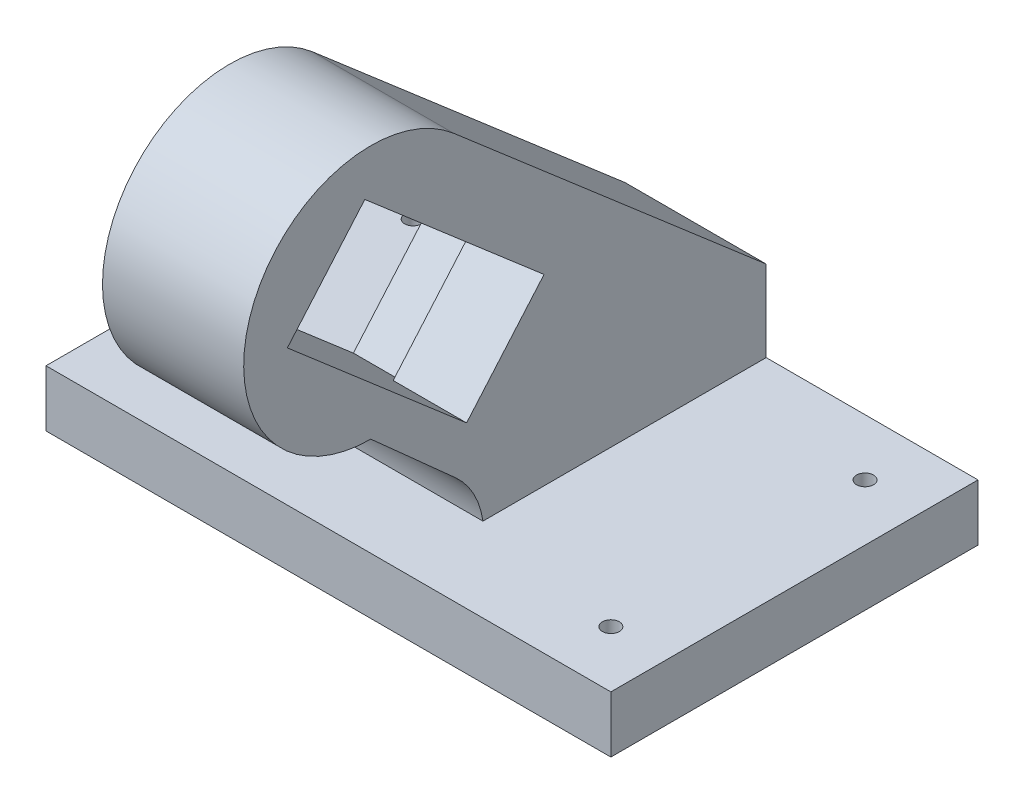
from build123d import *

# Parameters (mm, degrees)
SKETCH2_W               = 100
SKETCH2_H               = 100
BOSS_EXTRUDE1_DEPTH     = 10
SKETCH3_W               = 25
SKETCH3_H               = 100
BOSS_EXTRUDE2_DEPTH     = 100
CUT_EXTRUDE3_DEPTH      = 137.037678604
CUT_EXTRUDE3_DEPTH_BACK = 137.037678604
CUT_EXTRUDE4_DEPTH      = 112.411399776
CUT_EXTRUDE4_DEPTH_BACK = 112.411399776
CUT_EXTRUDE5_DEPTH      = 12
CUT_EXTRUDE7_DEPTH      = 105.910676292
CUT_EXTRUDE7_DEPTH_BACK = 10
SKETCH16_W              = 100
SKETCH16_H              = 35
SKETCH17_R              = 1.5
CUT_EXTRUDE8_DEPTH      = 105.910676292


with BuildPart() as part:
    # Sketch2 → Boss-Extrude1 (new body)
    with BuildSketch(Plane(origin=(0, 0, 0), x_dir=(1, 0, 0), z_dir=(0, 1, 0))):
        Rectangle(SKETCH2_W, SKETCH2_H)
    extrude(amount=BOSS_EXTRUDE1_DEPTH)

    # Sketch3 → Boss-Extrude2 (add)
    with BuildSketch(Plane(origin=(0, 10, 0), x_dir=(1, 0, 0), z_dir=(0, 1, 0))):
        Rectangle(SKETCH3_W, SKETCH3_H)
    extrude(amount=BOSS_EXTRUDE2_DEPTH)

    # Sketch4 → Cut-Extrude3 (cut, two sides: drawn at the far end of the back side and taken through both)
    with BuildSketch(Plane.ZY.offset(12.5).offset(-CUT_EXTRUDE3_DEPTH_BACK)):
        with BuildLine():
            ThreePointArc((5, 19.083592135), (1.769637802, 14.971315355), (0.147267966, 10))
            Line((0.147267966, 10), (50, 10))
            Line((50, 10), (50, 110))
            Line((50, 110), (-50, 110))
            Line((-50, 110), (-50, 24.347807147))
            Line((-50, 24.347807147), (5.30640787, 72.039611214))
            ThreePointArc((5.30640787, 72.039611214), (29.371344009, 75.45551054), (42.5, 55))
            ThreePointArc((42.5, 55), (35.909902577, 39.090097423), (20, 32.5))
            Line((20, 32.5), (5, 19.083592135))
        make_face()
    extrude(amount=CUT_EXTRUDE3_DEPTH + CUT_EXTRUDE3_DEPTH_BACK, mode=Mode.SUBTRACT)

    # Sketch13 → Cut-Extrude4 (cut, two sides: drawn at the far end of the back side and taken through both)
    with BuildSketch(Plane.ZY.offset(12.5).offset(-CUT_EXTRUDE4_DEPTH_BACK)):
        Polygon((3.039419763, 26.509804879), (-10.674599558, 42.413442012), (21.056943103, 69.7761758), (34.770962424, 53.872538667), align=None)
    extrude(amount=CUT_EXTRUDE4_DEPTH + CUT_EXTRUDE4_DEPTH_BACK, mode=Mode.SUBTRACT)

    # Sketch14 → Cut-Extrude5 (cut)
    with BuildSketch(Plane.ZY.offset(12.5)):
        Polygon((-15.635019711, 38.135974081), (-1.92100039, 22.232336948), (39.731382578, 58.150006598), (26.017363257, 74.053643731), align=None)
    extrude(amount=-CUT_EXTRUDE5_DEPTH, mode=Mode.SUBTRACT)

    # Sketch16 → Cut-Extrude7 (cut, two sides: drawn at the far end of the back side and taken through both)
    with BuildSketch(Plane.XZ.offset(-CUT_EXTRUDE7_DEPTH_BACK)):
        with Locations((0, 32.5)):
            Rectangle(SKETCH16_W, SKETCH16_H)
    extrude(amount=CUT_EXTRUDE7_DEPTH + CUT_EXTRUDE7_DEPTH_BACK, mode=Mode.SUBTRACT)

    # Sketch17 → Cut-Extrude8 (cut, through all)
    with BuildSketch(Plane.XZ):
        with Locations(Location((-40, 5, 0), (0, 0, 270))):
            Circle(SKETCH17_R)
        with Locations(Location((40, 5, 0), (0, 0, 270))):
            Circle(SKETCH17_R)
        with Locations(Location((40, -40, 0), (0, 0, 270))):
            Circle(SKETCH17_R)
        with Locations(Location((-40, -40, 0), (0, 0, 270))):
            Circle(SKETCH17_R)
    extrude(amount=-CUT_EXTRUDE8_DEPTH, mode=Mode.SUBTRACT)


solid = part.part
